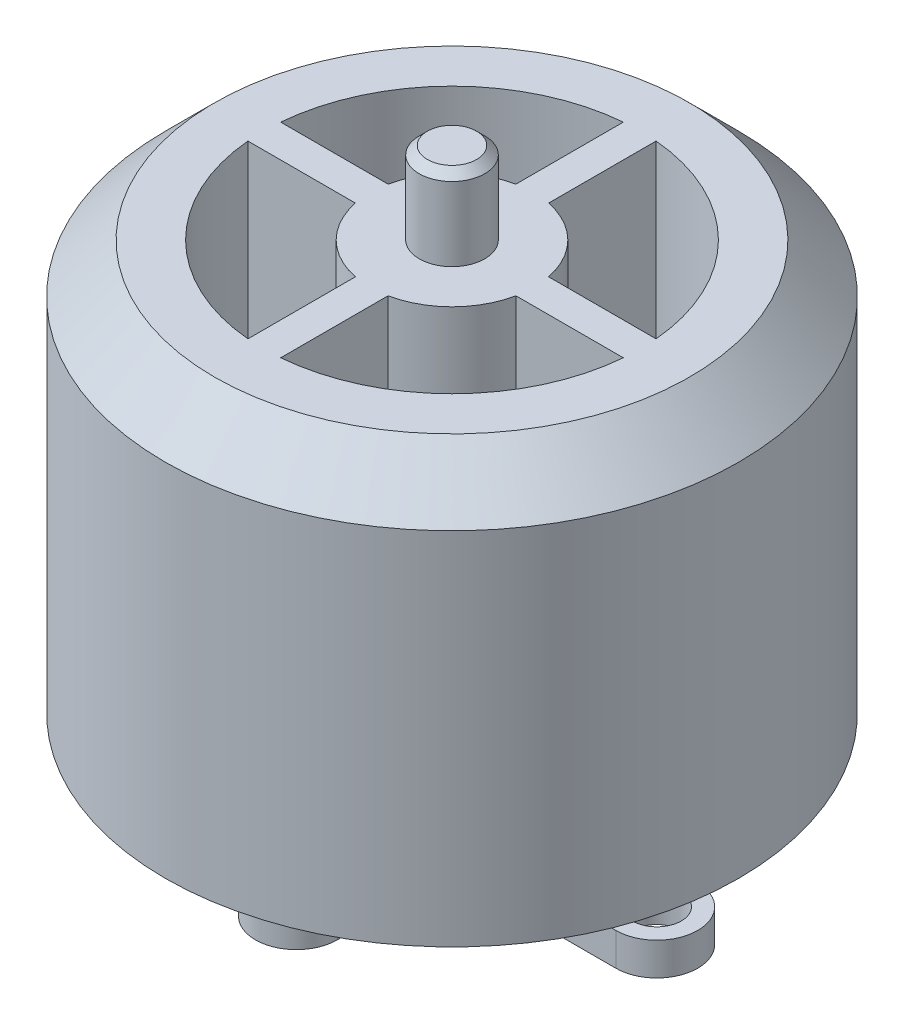
from build123d import *

# Parameters (mm, degrees)
SKETCH_1_R          = 1.5
EXTRUDE_1_DEPTH     = 2
SKETCH_1_3_R        = 2
EXTRUDE_2_DEPTH     = 34
EXTRUDE_START       = 4
SKETCH_2_R          = 17.5
EXTRUDE_3_DEPTH     = 25
CHAMFER_1_SIZE      = 3
CUT_EXTRUDE_1_DEPTH = 25
CHAMFER_2_SIZE      = 0.5


with BuildPart() as part:
    # 스케치1 → 보스-돌출1 (new body)
    with BuildSketch(Plane(origin=(0, 0, 0), x_dir=(1, 0, 0), z_dir=(0, 1, 0))):
        with BuildLine():
            Line((-2.5, -2.5), (-2.5, -9.5))
            ThreePointArc((-2.5, -9.5), (0, -12), (2.5, -9.5))
            Line((2.5, -9.5), (2.5, -2.5))
            Line((2.5, -2.5), (12.5, -2.5))
            ThreePointArc((12.5, -2.5), (15, 0), (12.5, 2.5))
            Line((12.5, 2.5), (2.5, 2.5))
            Line((2.5, 2.5), (2.5, 9.5))
            ThreePointArc((2.5, 9.5), (0, 12), (-2.5, 9.5))
            Line((-2.5, 9.5), (-2.5, 2.5))
            Line((-2.5, 2.5), (-12.5, 2.5))
            ThreePointArc((-12.5, 2.5), (-15, 0), (-12.5, -2.5))
            Line((-12.5, -2.5), (-2.5, -2.5))
        make_face()
        with Locations((0, -9.5)):
            Circle(SKETCH_1_R, mode=Mode.SUBTRACT)
        with Locations((-8, 0)):
            Circle(SKETCH_1_R, mode=Mode.SUBTRACT)
        with Locations((-12.5, 0)):
            Circle(SKETCH_1_R, mode=Mode.SUBTRACT)
        with Locations((0, 9.5)):
            Circle(SKETCH_1_R, mode=Mode.SUBTRACT)
        with Locations((12.5, 0)):
            Circle(SKETCH_1_R, mode=Mode.SUBTRACT)
        with Locations((8, 0)):
            Circle(SKETCH_1_R, mode=Mode.SUBTRACT)
    extrude(amount=-EXTRUDE_1_DEPTH)

    # 스케치1<3> → 보스-돌출2 (add)
    with BuildSketch(Plane(origin=(0, 0, 0), x_dir=(1, 0, 0), z_dir=(0, 1, 0))):
        Circle(SKETCH_1_3_R)
    extrude(amount=EXTRUDE_2_DEPTH)

    # 스케치2 → 보스-돌출3 (add)
    with BuildSketch(Plane(origin=(0, 0, 0), x_dir=(1, 0, 0), z_dir=(0, 1, 0)).offset(EXTRUDE_START)):
        Circle(SKETCH_2_R)
    extrude(amount=EXTRUDE_3_DEPTH)

    # 모따기1
    chamfer_1_edges = [part.edges().sort_by_distance(p)[0] for p in [
        (-17.5, 29, 0),
    ]]
    chamfer(chamfer_1_edges, length=CHAMFER_1_SIZE)

    # 스케치4 → 컷-돌출1 (cut)
    with BuildSketch(Plane(origin=(0, 29, 0), x_dir=(1, 0, 0), z_dir=(0, 1, 0))):
        with BuildLine():
            Line((-1, 4.898979486), (-1, 11.456439237))
            ThreePointArc((-1, 11.456439237), (-8.131727984, 8.131727984), (-11.456439237, 1))
            Line((-11.456439237, 1), (-4.898979486, 1))
            ThreePointArc((-4.898979486, 1), (-3.535533906, 3.535533906), (-1, 4.898979486))
        make_face()
        with BuildLine():
            Line((4.898979486, 1), (11.456439237, 1))
            ThreePointArc((11.456439237, 1), (8.131727984, 8.131727984), (1, 11.456439237))
            Line((1, 11.456439237), (1, 4.898979486))
            ThreePointArc((1, 4.898979486), (3.535533906, 3.535533906), (4.898979486, 1))
        make_face()
        with BuildLine():
            Line((1, -4.898979486), (1, -11.456439237))
            ThreePointArc((1, -11.456439237), (8.131727984, -8.131727984), (11.456439237, -1))
            Line((11.456439237, -1), (4.898979486, -1))
            ThreePointArc((4.898979486, -1), (3.535533906, -3.535533906), (1, -4.898979486))
        make_face()
        with BuildLine():
            Line((-4.898979486, -1), (-11.456439237, -1))
            ThreePointArc((-11.456439237, -1), (-8.131727984, -8.131727984), (-1, -11.456439237))
            Line((-1, -11.456439237), (-1, -4.898979486))
            ThreePointArc((-1, -4.898979486), (-3.535533906, -3.535533906), (-4.898979486, -1))
        make_face()
    extrude(amount=-CUT_EXTRUDE_1_DEPTH, mode=Mode.SUBTRACT)

    # 모따기2
    chamfer_2_edges = [part.edges().sort_by_distance(p)[0] for p in [
        (-2, 34, 0),
    ]]
    chamfer(chamfer_2_edges, length=CHAMFER_2_SIZE)


solid = part.part
